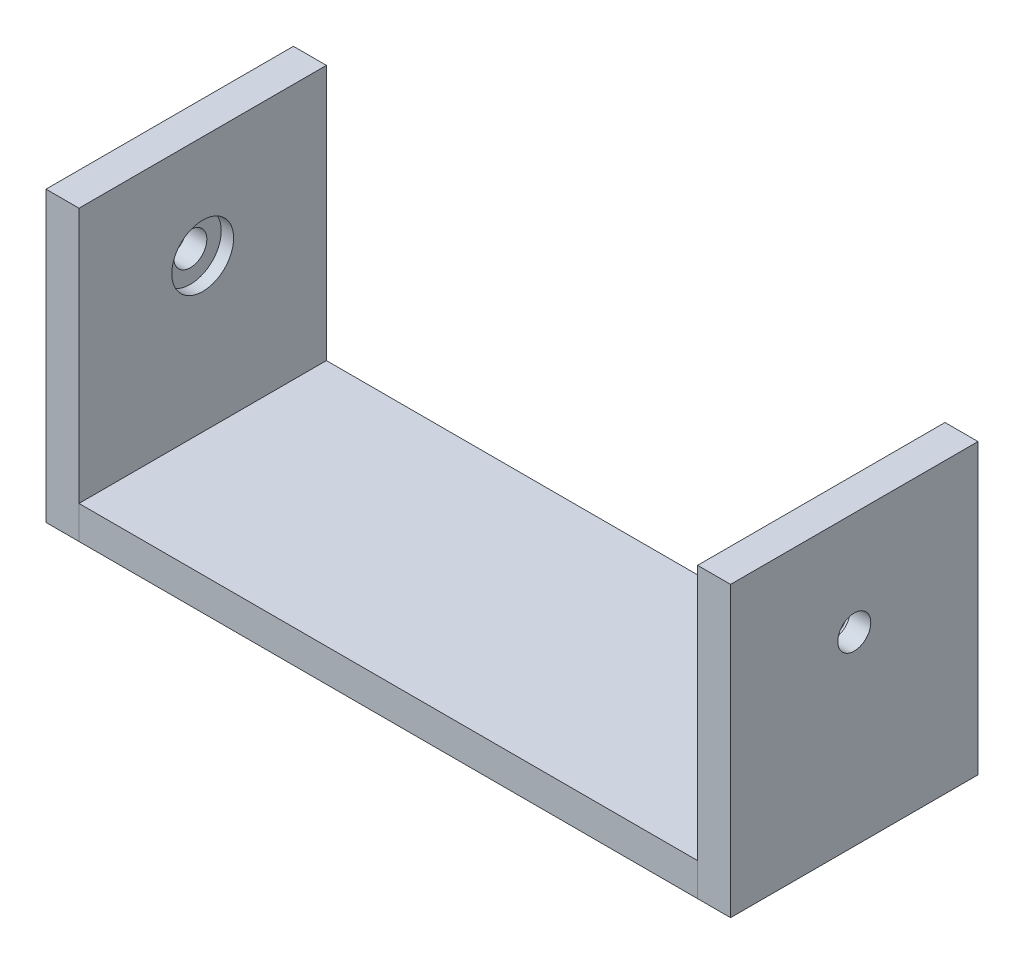
from build123d import *

# Parameters (mm, degrees)
SKETCH1_W           = 150
SKETCH1_H           = 8
BOSS_EXTRUDE1_DEPTH = 60
SKETCH2_W           = 60
SKETCH2_H           = 70
BOSS_EXTRUDE2_DEPTH = 8
SKETCH3_W           = 60
SKETCH3_H           = 70
BOSS_EXTRUDE3_DEPTH = 8
SKETCH4_R           = 4
CUT_EXTRUDE1_DEPTH  = 189.446278817
SKETCH5_R           = 7.5
CUT_EXTRUDE2_DEPTH  = 3
SKETCH6_R           = 7.5
CUT_EXTRUDE3_DEPTH  = 3


with BuildPart() as part:
    # Sketch1 → Boss-Extrude1 (new body)
    with BuildSketch(Plane.XY):
        Rectangle(SKETCH1_W, SKETCH1_H)
    extrude(amount=BOSS_EXTRUDE1_DEPTH)


with BuildPart() as body_2:
    # Sketch2 → Boss-Extrude2 (new body)
    with BuildSketch(Plane(origin=(75, 0, 0), x_dir=(0, 0, -1), z_dir=(1, 0, 0))):
        with Locations((-30, 31)):
            Rectangle(SKETCH2_W, SKETCH2_H)
    extrude(amount=BOSS_EXTRUDE2_DEPTH)


with BuildPart() as body_3:
    # Sketch3 → Boss-Extrude3 (new body)
    with BuildSketch(Plane.ZY.offset(75)):
        with Locations((30, 31)):
            Rectangle(SKETCH3_W, SKETCH3_H)
    extrude(amount=BOSS_EXTRUDE3_DEPTH)


with BuildPart() as cut_extrude1_tool:
    # Sketch4 → Cut-Extrude1 (new, through all)
    with BuildSketch(Plane(origin=(83, 0, 0), x_dir=(0, 0, -1), z_dir=(1, 0, 0))):
        with Locations((-30, 41)):
            Circle(SKETCH4_R)
    extrude(amount=-CUT_EXTRUDE1_DEPTH)


with BuildPart() as body_2_1:
    add(body_2.part)

    # Cut-Extrude1: cut by cut_extrude1_tool
    add(cut_extrude1_tool.part, mode=Mode.SUBTRACT)

    # Sketch5 → Cut-Extrude2 (cut)
    with BuildSketch(Plane.ZY.offset(-75)):
        with Locations((30, 41)):
            Circle(SKETCH5_R)
    extrude(amount=-CUT_EXTRUDE2_DEPTH, mode=Mode.SUBTRACT)


with BuildPart() as body_3_1:
    add(body_3.part)

    # Cut-Extrude1: cut by cut_extrude1_tool
    add(cut_extrude1_tool.part, mode=Mode.SUBTRACT)

    # Sketch6 → Cut-Extrude3 (cut)
    with BuildSketch(Plane(origin=(-75, 0, 0), x_dir=(0, 0, -1), z_dir=(1, 0, 0))):
        with Locations((-30, 41)):
            Circle(SKETCH6_R)
    extrude(amount=-CUT_EXTRUDE3_DEPTH, mode=Mode.SUBTRACT)


solid = Compound([part.part, body_2_1.part, body_3_1.part])
